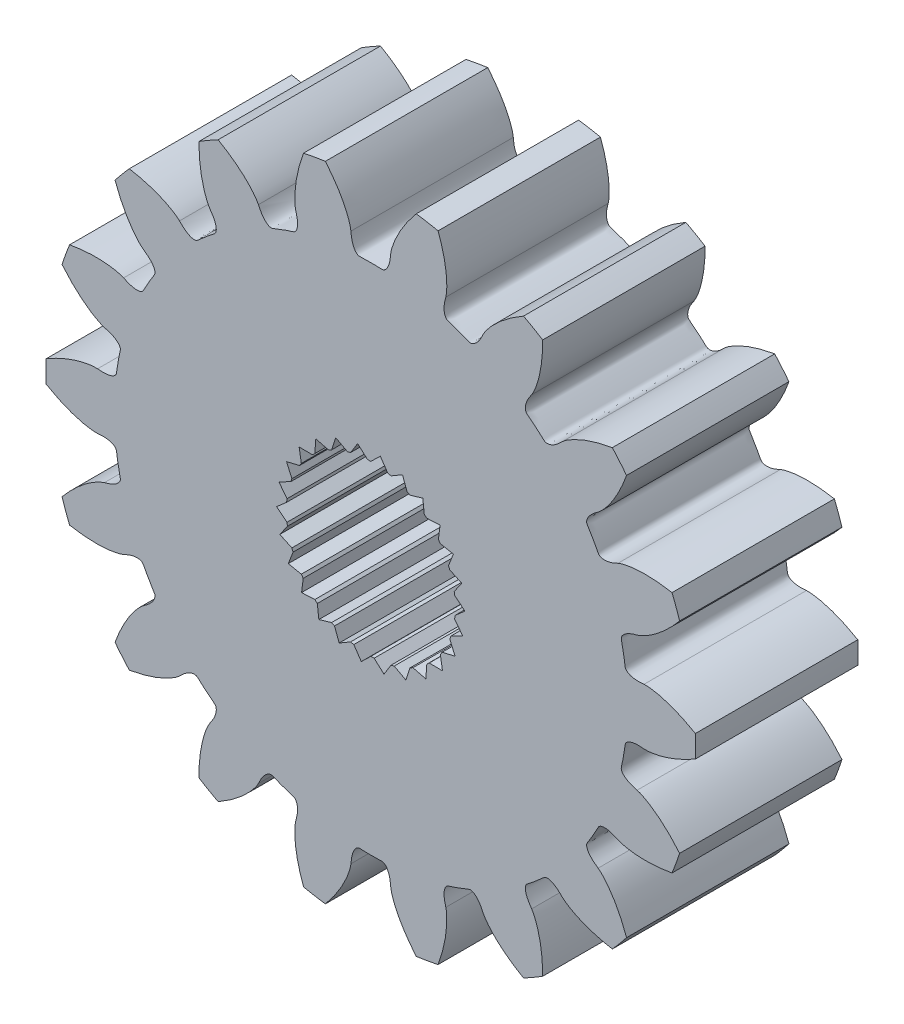
from build123d import *

# Parameters (mm, degrees)
BOSS_EXTRUDE1_DEPTH   = 5
IZIM1_R               = 2.6
KES_EKSTR_ZYON1_DEPTH = 4
IZIM3_R               = 0.95
KES_EKSTR_ZYON2_DEPTH = 15.630121998


with BuildPart() as part:
    # Model → Boss-Extrude1 (new body)
    with BuildSketch(Plane.XY):
        with BuildLine():
            ThreePointArc((-4.701939257, 8.825631265), (-5, 8.660254038), (-5.292251252, 8.484814476))
            add(Edge.make_bspline(
                [(-5.292251252, 8.484814476), (-5.291891635, 8.41467126), (-5.2911724, 8.274384291), (-5.278725206, 8.064251789), (-5.257404555, 7.854871363), (-5.225513528, 7.646803947), (-5.182173314, 7.440810054), (-5.135098328, 7.271767276), (-5.089713946, 7.138995986), (-5.050911451, 7.041215912), (-5.007874686, 6.94505322), (-4.971743121, 6.884900749), (-4.953682054, 6.854832365)],
                knots=[-0.1683093, -0.1683093, -0.1683093, -0.1683093, -0.14726919, -0.126228918, -0.105188912, -0.084149352, -0.063110491, -0.042072895, -0.031552683, -0.021032787, -0.010513648, 0, 0, 0, 0], degree=3))
            add(Edge.make_bspline(
                [(-4.953682054, 6.854832365), (-4.92962727, 6.821129291), (-4.881522109, 6.753729317), (-4.831274254, 6.662946551), (-4.797883212, 6.587157775), (-4.777404914, 6.528468048), (-4.762818133, 6.467994251), (-4.756375253, 6.406103034), (-4.761015283, 6.354003405), (-4.77405193, 6.314600894), (-4.794525367, 6.278147733), (-4.835324643, 6.244864353), (-4.901681916, 6.196008653), (-4.983427365, 6.132175875), (-5.077763526, 6.051442925), (-5.173651264, 5.972559072), (-5.250709227, 5.903139965), (-5.310345519, 5.846274512), (-5.350207969, 5.811874667), (-5.3896625, 5.798042292), (-5.430730188, 5.792045875), (-5.482844039, 5.796523343), (-5.542676195, 5.813615638), (-5.599698292, 5.838481978), (-5.653940371, 5.868840529), (-5.722779452, 5.914884869), (-5.803457574, 5.980133607), (-5.861480218, 6.039211826), (-5.890494197, 6.068753641)],
                knots=[-0.198614223, -0.198614223, -0.198614223, -0.198614223, -0.186198487, -0.173785025, -0.167576252, -0.161368033, -0.155160905, -0.148956532, -0.142760006, -0.139657124, -0.136554092, -0.130358143, -0.124146484, -0.111726376, -0.099307112, -0.086887847, -0.074467739, -0.06825608, -0.062060131, -0.0589571, -0.055854217, -0.049657691, -0.043453318, -0.03724619, -0.031037971, -0.024829198, -0.012415736, 0, 0, 0, 0], degree=3))
            add(Edge.make_bspline(
                [(-5.890494197, 6.068753641), (-5.916969504, 6.09176164), (-5.969933943, 6.137789652), (-6.057162452, 6.196871069), (-6.146719044, 6.252063398), (-6.269592325, 6.319813782), (-6.427892478, 6.395527563), (-6.623230911, 6.473979806), (-6.822599497, 6.541516864), (-7.025096671, 6.598872137), (-7.229875356, 6.647619356), (-7.367906157, 6.67268824), (-7.436921293, 6.685222635)],
                knots=[-0.1683093, -0.1683093, -0.1683093, -0.1683093, -0.157795652, -0.147276513, -0.136756617, -0.126236405, -0.10519881, -0.084159949, -0.063120388, -0.042080382, -0.021040111, 0, 0, 0, 0], degree=3))
            ThreePointArc((-7.436921293, 6.685222635), (-7.660444431, 6.427876097), (-7.875066912, 6.16306102))
            add(Edge.make_bspline(
                [(-7.875066912, 6.16306102), (-7.85073859, 6.097270953), (-7.802081761, 5.965690317), (-7.718515676, 5.772487546), (-7.626868494, 5.583026398), (-7.525737484, 5.398414356), (-7.414556944, 5.219666641), (-7.312504892, 5.076918983), (-7.224447067, 4.967677155), (-7.154541895, 4.889065176), (-7.081210986, 4.813421244), (-7.026685064, 4.769254134), (-6.999429219, 4.747176344)],
                knots=[-0.1683093, -0.1683093, -0.1683093, -0.1683093, -0.14726919, -0.126228918, -0.105188912, -0.084149352, -0.063110491, -0.042072895, -0.031552683, -0.021032787, -0.010513648, 0, 0, 0, 0], degree=3))
            add(Edge.make_bspline(
                [(-6.999429219, 4.747176344), (-6.965297987, 4.723733035), (-6.897041773, 4.67685071), (-6.8187747, 4.608728594), (-6.761476096, 4.54893085), (-6.722159722, 4.500784536), (-6.687769374, 4.448946728), (-6.660547004, 4.392991603), (-6.647088084, 4.342446983), (-6.645862073, 4.300961938), (-6.652633095, 4.259704844), (-6.679588287, 4.214474523), (-6.725234093, 4.145869658), (-6.780217593, 4.057927877), (-6.841252292, 3.949798853), (-6.904377425, 3.84287674), (-6.953045491, 3.751288742), (-6.989636144, 3.677455882), (-7.015329155, 3.631496841), (-7.047673336, 3.605004416), (-7.084213444, 3.585323651), (-7.134715829, 3.571707107), (-7.196785574, 3.567304809), (-7.258873606, 3.571168819), (-7.320227724, 3.581144642), (-7.400663392, 3.600867816), (-7.498792411, 3.634588031), (-7.573521802, 3.670258484), (-7.61088992, 3.688095344)],
                knots=[-0.198614223, -0.198614223, -0.198614223, -0.198614223, -0.186198487, -0.173785025, -0.167576252, -0.161368033, -0.155160905, -0.148956532, -0.142760006, -0.139657124, -0.136554092, -0.130358143, -0.124146484, -0.111726376, -0.099307112, -0.086887847, -0.074467739, -0.06825608, -0.062060131, -0.0589571, -0.055854217, -0.049657691, -0.043453318, -0.03724619, -0.031037971, -0.024829198, -0.012415736, 0, 0, 0, 0], degree=3))
            add(Edge.make_bspline(
                [(-7.61088992, 3.688095344), (-7.643637769, 3.700660703), (-7.709150569, 3.725797982), (-7.81132559, 3.751482445), (-7.914358147, 3.772716111), (-8.052993258, 3.79435551), (-8.227642383, 3.81136135), (-8.438032714, 3.818272665), (-8.648476938, 3.813548668), (-8.858378696, 3.798186882), (-9.067480246, 3.773955849), (-9.205760834, 3.750303581), (-9.274900864, 3.738477492)],
                knots=[-0.1683093, -0.1683093, -0.1683093, -0.1683093, -0.157795652, -0.147276513, -0.136756617, -0.126236405, -0.10519881, -0.084159949, -0.063120388, -0.042080382, -0.021040111, 0, 0, 0, 0], degree=3))
            ThreePointArc((-9.274900864, 3.738477492), (-9.396926208, 3.420201433), (-9.508033278, 3.097951448))
            add(Edge.make_bspline(
                [(-9.508033278, 3.097951448), (-9.462670606, 3.044449784), (-9.371944915, 2.937446047), (-9.227339242, 2.784476113), (-9.076419532, 2.637786052), (-8.918246431, 2.498896321), (-8.752635579, 2.368954397), (-8.607915445, 2.269719334), (-8.487805251, 2.197183143), (-8.395228996, 2.147221024), (-8.300448734, 2.101219627), (-8.234105085, 2.078365084), (-8.200941921, 2.066940795)],
                knots=[-0.1683093, -0.1683093, -0.1683093, -0.1683093, -0.14726919, -0.126228918, -0.105188912, -0.084149352, -0.063110491, -0.042072895, -0.031552683, -0.021032787, -0.010513648, 0, 0, 0, 0], degree=3))
            add(Edge.make_bspline(
                [(-8.200941921, 2.066940795), (-8.16085097, 2.05658486), (-8.080676409, 2.035874885), (-7.983830283, 1.998629951), (-7.909535175, 1.962035728), (-7.856122858, 1.930239985), (-7.806076928, 1.893290571), (-7.761358488, 1.850020552), (-7.731423962, 1.807127367), (-7.716083167, 1.768563497), (-7.70833509, 1.727478684), (-7.718195004, 1.675756867), (-7.737623785, 1.595677596), (-7.759213514, 1.494233889), (-7.779585066, 1.371750746), (-7.802333771, 1.249686759), (-7.816741853, 1.146976734), (-7.825873495, 1.0650818), (-7.834298109, 1.0131069), (-7.855630754, 0.977149804), (-7.883236006, 0.94615848), (-7.926035593, 0.916090282), (-7.982856399, 0.890724371), (-8.042521634, 0.873119996), (-8.103587578, 0.861509859), (-8.185918105, 0.852532961), (-8.289662213, 0.850657497), (-8.372084884, 0.858617802), (-8.413299993, 0.862598319)],
                knots=[-0.198614223, -0.198614223, -0.198614223, -0.198614223, -0.186198487, -0.173785025, -0.167576252, -0.161368033, -0.155160905, -0.148956532, -0.142760006, -0.139657124, -0.136554092, -0.130358143, -0.124146484, -0.111726376, -0.099307112, -0.086887847, -0.074467739, -0.06825608, -0.062060131, -0.0589571, -0.055854217, -0.049657691, -0.043453318, -0.03724619, -0.031037971, -0.024829198, -0.012415736, 0, 0, 0, 0], degree=3))
            add(Edge.make_bspline(
                [(-8.413299993, 0.862598319), (-8.448370511, 0.863205469), (-8.518529862, 0.864420087), (-8.623327579, 0.853609673), (-8.727408854, 0.838323582), (-8.865084356, 0.811241965), (-9.035017189, 0.767488709), (-9.23508324, 0.702025489), (-9.431220421, 0.625610221), (-9.623209515, 0.539384234), (-9.811413197, 0.445097569), (-9.933264893, 0.375576961), (-9.994190508, 0.340816789)],
                knots=[-0.1683093, -0.1683093, -0.1683093, -0.1683093, -0.157795652, -0.147276513, -0.136756617, -0.126236405, -0.10519881, -0.084159949, -0.063120388, -0.042080382, -0.021040111, 0, 0, 0, 0], degree=3))
            ThreePointArc((-9.994190508, 0.340816789), (-10, 0), (-9.994190508, -0.340816789))
            add(Edge.make_bspline(
                [(-9.994190508, -0.340816789), (-9.933264893, -0.375576961), (-9.811413197, -0.445097569), (-9.623209515, -0.539384234), (-9.431220421, -0.625610221), (-9.23508324, -0.702025489), (-9.035017189, -0.767488709), (-8.865084356, -0.811241965), (-8.727408854, -0.838323582), (-8.623327579, -0.853609673), (-8.518529862, -0.864420087), (-8.448370511, -0.863205469), (-8.413299993, -0.862598319)],
                knots=[-0.1683093, -0.1683093, -0.1683093, -0.1683093, -0.14726919, -0.126228918, -0.105188912, -0.084149352, -0.063110491, -0.042072895, -0.031552683, -0.021032787, -0.010513648, 0, 0, 0, 0], degree=3))
            add(Edge.make_bspline(
                [(-8.413299993, -0.862598319), (-8.372084884, -0.858617802), (-8.289662213, -0.850657497), (-8.185918105, -0.852532961), (-8.103587578, -0.861509859), (-8.042521634, -0.873119996), (-7.982856399, -0.890724371), (-7.926035593, -0.916090282), (-7.883236006, -0.94615848), (-7.855630754, -0.977149804), (-7.834298109, -1.0131069), (-7.825873495, -1.0650818), (-7.816741853, -1.146976734), (-7.802333771, -1.249686759), (-7.779585066, -1.371750746), (-7.759213514, -1.494233889), (-7.737623785, -1.595677596), (-7.718195004, -1.675756867), (-7.70833509, -1.727478684), (-7.716083167, -1.768563497), (-7.731423962, -1.807127367), (-7.761358488, -1.850020552), (-7.806076928, -1.893290571), (-7.856122858, -1.930239985), (-7.909535175, -1.962035728), (-7.983830283, -1.998629951), (-8.080676409, -2.035874885), (-8.16085097, -2.05658486), (-8.200941921, -2.066940795)],
                knots=[-0.198614223, -0.198614223, -0.198614223, -0.198614223, -0.186198487, -0.173785025, -0.167576252, -0.161368033, -0.155160905, -0.148956532, -0.142760006, -0.139657124, -0.136554092, -0.130358143, -0.124146484, -0.111726376, -0.099307112, -0.086887847, -0.074467739, -0.06825608, -0.062060131, -0.0589571, -0.055854217, -0.049657691, -0.043453318, -0.03724619, -0.031037971, -0.024829198, -0.012415736, 0, 0, 0, 0], degree=3))
            add(Edge.make_bspline(
                [(-8.200941921, -2.066940795), (-8.234105085, -2.078365084), (-8.300448734, -2.101219627), (-8.395228996, -2.147221024), (-8.487805251, -2.197183143), (-8.607915445, -2.269719334), (-8.752635579, -2.368954397), (-8.918246431, -2.498896321), (-9.076419532, -2.637786052), (-9.227339242, -2.784476113), (-9.371944915, -2.937446047), (-9.462670606, -3.044449784), (-9.508033278, -3.097951448)],
                knots=[-0.1683093, -0.1683093, -0.1683093, -0.1683093, -0.157795652, -0.147276513, -0.136756617, -0.126236405, -0.10519881, -0.084159949, -0.063120388, -0.042080382, -0.021040111, 0, 0, 0, 0], degree=3))
            ThreePointArc((-9.508033278, -3.097951448), (-9.396926208, -3.420201433), (-9.274900864, -3.738477492))
            add(Edge.make_bspline(
                [(-9.274900864, -3.738477492), (-9.205760834, -3.750303581), (-9.067480246, -3.773955849), (-8.858378696, -3.798186882), (-8.648476938, -3.813548668), (-8.438032714, -3.818272665), (-8.227642383, -3.81136135), (-8.052993258, -3.79435551), (-7.914358147, -3.772716111), (-7.81132559, -3.751482445), (-7.709150569, -3.725797982), (-7.643637769, -3.700660703), (-7.61088992, -3.688095344)],
                knots=[-0.1683093, -0.1683093, -0.1683093, -0.1683093, -0.14726919, -0.126228918, -0.105188912, -0.084149352, -0.063110491, -0.042072895, -0.031552683, -0.021032787, -0.010513648, 0, 0, 0, 0], degree=3))
            add(Edge.make_bspline(
                [(-7.61088992, -3.688095344), (-7.573521802, -3.670258484), (-7.498792411, -3.634588031), (-7.400663392, -3.600867816), (-7.320227724, -3.581144642), (-7.258873606, -3.571168819), (-7.196785574, -3.567304809), (-7.134715829, -3.571707107), (-7.084213444, -3.585323651), (-7.047673336, -3.605004416), (-7.015329155, -3.631496841), (-6.989636144, -3.677455882), (-6.953045491, -3.751288742), (-6.904377425, -3.84287674), (-6.841252292, -3.949798853), (-6.780217593, -4.057927877), (-6.725234093, -4.145869658), (-6.679588287, -4.214474523), (-6.652633095, -4.259704844), (-6.645862073, -4.300961938), (-6.647088084, -4.342446983), (-6.660547004, -4.392991603), (-6.687769374, -4.448946728), (-6.722159722, -4.500784536), (-6.761476096, -4.54893085), (-6.8187747, -4.608728594), (-6.897041773, -4.67685071), (-6.965297987, -4.723733035), (-6.999429219, -4.747176344)],
                knots=[-0.198614223, -0.198614223, -0.198614223, -0.198614223, -0.186198487, -0.173785025, -0.167576252, -0.161368033, -0.155160905, -0.148956532, -0.142760006, -0.139657124, -0.136554092, -0.130358143, -0.124146484, -0.111726376, -0.099307112, -0.086887847, -0.074467739, -0.06825608, -0.062060131, -0.0589571, -0.055854217, -0.049657691, -0.043453318, -0.03724619, -0.031037971, -0.024829198, -0.012415736, 0, 0, 0, 0], degree=3))
            add(Edge.make_bspline(
                [(-6.999429219, -4.747176344), (-7.026685064, -4.769254134), (-7.081210986, -4.813421244), (-7.154541895, -4.889065176), (-7.224447067, -4.967677155), (-7.312504892, -5.076918983), (-7.414556944, -5.219666641), (-7.525737484, -5.398414356), (-7.626868494, -5.583026398), (-7.718515676, -5.772487546), (-7.802081761, -5.965690317), (-7.85073859, -6.097270953), (-7.875066912, -6.16306102)],
                knots=[-0.1683093, -0.1683093, -0.1683093, -0.1683093, -0.157795652, -0.147276513, -0.136756617, -0.126236405, -0.10519881, -0.084159949, -0.063120388, -0.042080382, -0.021040111, 0, 0, 0, 0], degree=3))
            ThreePointArc((-7.875066912, -6.16306102), (-7.660444431, -6.427876097), (-7.436921293, -6.685222635))
            add(Edge.make_bspline(
                [(-7.436921293, -6.685222635), (-7.367906157, -6.67268824), (-7.229875356, -6.647619356), (-7.025096671, -6.598872137), (-6.822599497, -6.541516864), (-6.623230911, -6.473979806), (-6.427892478, -6.395527563), (-6.269592325, -6.319813782), (-6.146719044, -6.252063398), (-6.057162452, -6.196871069), (-5.969933943, -6.137789652), (-5.916969504, -6.09176164), (-5.890494197, -6.068753641)],
                knots=[-0.1683093, -0.1683093, -0.1683093, -0.1683093, -0.14726919, -0.126228918, -0.105188912, -0.084149352, -0.063110491, -0.042072895, -0.031552683, -0.021032787, -0.010513648, 0, 0, 0, 0], degree=3))
            add(Edge.make_bspline(
                [(-5.890494197, -6.068753641), (-5.861480218, -6.039211826), (-5.803457574, -5.980133607), (-5.722779452, -5.914884869), (-5.653940371, -5.868840529), (-5.599698292, -5.838481978), (-5.542676195, -5.813615638), (-5.482844039, -5.796523343), (-5.430730188, -5.792045875), (-5.3896625, -5.798042292), (-5.350207969, -5.811874667), (-5.310345519, -5.846274512), (-5.250709227, -5.903139965), (-5.173651264, -5.972559072), (-5.077763526, -6.051442925), (-4.983427365, -6.132175875), (-4.901681916, -6.196008653), (-4.835324643, -6.244864353), (-4.794525367, -6.278147733), (-4.77405193, -6.314600894), (-4.761015283, -6.354003405), (-4.756375253, -6.406103034), (-4.762818133, -6.467994251), (-4.777404914, -6.528468048), (-4.797883212, -6.587157775), (-4.831274254, -6.662946551), (-4.881522109, -6.753729317), (-4.92962727, -6.821129291), (-4.953682054, -6.854832365)],
                knots=[-0.198614223, -0.198614223, -0.198614223, -0.198614223, -0.186198487, -0.173785025, -0.167576252, -0.161368033, -0.155160905, -0.148956532, -0.142760006, -0.139657124, -0.136554092, -0.130358143, -0.124146484, -0.111726376, -0.099307112, -0.086887847, -0.074467739, -0.06825608, -0.062060131, -0.0589571, -0.055854217, -0.049657691, -0.043453318, -0.03724619, -0.031037971, -0.024829198, -0.012415736, 0, 0, 0, 0], degree=3))
            add(Edge.make_bspline(
                [(-4.953682054, -6.854832365), (-4.971743121, -6.884900749), (-5.007874686, -6.94505322), (-5.050911451, -7.041215912), (-5.089713946, -7.138995986), (-5.135098328, -7.271767276), (-5.182173314, -7.440810054), (-5.225513528, -7.646803947), (-5.257404555, -7.854871363), (-5.278725206, -8.064251789), (-5.2911724, -8.274384291), (-5.291891635, -8.41467126), (-5.292251252, -8.484814476)],
                knots=[-0.1683093, -0.1683093, -0.1683093, -0.1683093, -0.157795652, -0.147276513, -0.136756617, -0.126236405, -0.10519881, -0.084159949, -0.063120388, -0.042080382, -0.021040111, 0, 0, 0, 0], degree=3))
            ThreePointArc((-5.292251252, -8.484814476), (-5, -8.660254038), (-4.701939257, -8.825631265))
            add(Edge.make_bspline(
                [(-4.701939257, -8.825631265), (-4.641373258, -8.79024822), (-4.520240797, -8.71948186), (-4.344484308, -8.603636023), (-4.173815867, -8.480481584), (-4.009569712, -8.348829436), (-3.852843875, -8.208298764), (-3.729986027, -8.083009241), (-3.637694908, -7.977319568), (-3.572416128, -7.894825585), (-3.510655176, -7.809473307), (-3.476627391, -7.748106218), (-3.45961794, -7.717430683)],
                knots=[-0.1683093, -0.1683093, -0.1683093, -0.1683093, -0.14726919, -0.126228918, -0.105188912, -0.084149352, -0.063110491, -0.042072895, -0.031552683, -0.021032787, -0.010513648, 0, 0, 0, 0], degree=3))
            add(Edge.make_bspline(
                [(-3.45961794, -7.717430683), (-3.442457614, -7.679747093), (-3.408140104, -7.604386814), (-3.35464385, -7.515479513), (-3.305704366, -7.448667634), (-3.26511672, -7.401588044), (-3.220038266, -7.358718622), (-3.16966034, -7.322193316), (-3.122220723, -7.300161885), (-3.081578824, -7.291750698), (-3.039772742, -7.291254634), (-2.990548852, -7.309946153), (-2.915059938, -7.342985387), (-2.818906405, -7.381862634), (-2.701821539, -7.423193671), (-2.58556225, -7.466792961), (-2.486914558, -7.498817561), (-2.407849485, -7.522031378), (-2.35812712, -7.53935335), (-2.326420667, -7.566605789), (-2.300693774, -7.599173242), (-2.278514449, -7.646543894), (-2.263400733, -7.706906209), (-2.256424567, -7.768721963), (-2.255594804, -7.830876257), (-2.261050831, -7.91351482), (-2.277218835, -8.016008493), (-2.299370751, -8.095796686), (-2.310447724, -8.135694436)],
                knots=[-0.198614223, -0.198614223, -0.198614223, -0.198614223, -0.186198487, -0.173785025, -0.167576252, -0.161368033, -0.155160905, -0.148956532, -0.142760006, -0.139657124, -0.136554092, -0.130358143, -0.124146484, -0.111726376, -0.099307112, -0.086887847, -0.074467739, -0.06825608, -0.062060131, -0.0589571, -0.055854217, -0.049657691, -0.043453318, -0.03724619, -0.031037971, -0.024829198, -0.012415736, 0, 0, 0, 0], degree=3))
            add(Edge.make_bspline(
                [(-2.310447724, -8.135694436), (-2.317135582, -8.170126723), (-2.330514791, -8.23900928), (-2.338066544, -8.344092093), (-2.341086207, -8.449246541), (-2.33832312, -8.589533116), (-2.324743101, -8.76448196), (-2.29501552, -8.972876127), (-2.253820035, -9.179302917), (-2.202242571, -9.38334825), (-2.142069559, -9.585065403), (-2.09476445, -9.717138024), (-2.071111985, -9.783174083)],
                knots=[-0.1683093, -0.1683093, -0.1683093, -0.1683093, -0.157795652, -0.147276513, -0.136756617, -0.126236405, -0.10519881, -0.084159949, -0.063120388, -0.042080382, -0.021040111, 0, 0, 0, 0], degree=3))
            ThreePointArc((-2.071111985, -9.783174083), (-1.736481777, -9.84807753), (-1.399833953, -9.901538512))
            add(Edge.make_bspline(
                [(-1.399833953, -9.901538512), (-1.355022244, -9.847574534), (-1.265398485, -9.739646166), (-1.13986302, -9.570674428), (-1.021608444, -9.396575066), (-0.91229523, -9.216687021), (-0.813085439, -9.031027992), (-0.740488367, -8.871274493), (-0.68991108, -8.740393266), (-0.656783695, -8.640547621), (-0.627939583, -8.539219225), (-0.616952705, -8.469914837), (-0.6114607, -8.435271688)],
                knots=[-0.1683093, -0.1683093, -0.1683093, -0.1683093, -0.14726919, -0.126228918, -0.105188912, -0.084149352, -0.063110491, -0.042072895, -0.031552683, -0.021032787, -0.010513648, 0, 0, 0, 0], degree=3))
            add(Edge.make_bspline(
                [(-0.6114607, -8.435271688), (-0.608223815, -8.393991519), (-0.601750639, -8.311438741), (-0.581888691, -8.20959641), (-0.558751628, -8.130075491), (-0.536713885, -8.071953355), (-0.5090162, -8.016251537), (-0.474168825, -7.96469871), (-0.43712536, -7.927770633), (-0.401811262, -7.905966355), (-0.36269606, -7.891201685), (-0.310047857, -7.891930405), (-0.227811398, -7.8971584), (-0.124159832, -7.900804617), (0, -7.899597705), (0.124159832, -7.900804617), (0.227811398, -7.8971584), (0.310047857, -7.891930405), (0.36269606, -7.891201685), (0.401811262, -7.905966355), (0.43712536, -7.927770633), (0.474168825, -7.96469871), (0.5090162, -8.016251537), (0.536713885, -8.071953355), (0.558751628, -8.130075491), (0.581888691, -8.20959641), (0.601750639, -8.311438741), (0.608223815, -8.393991519), (0.6114607, -8.435271688)],
                knots=[-0.198614223, -0.198614223, -0.198614223, -0.198614223, -0.186198487, -0.173785025, -0.167576252, -0.161368033, -0.155160905, -0.148956532, -0.142760006, -0.139657124, -0.136554092, -0.130358143, -0.124146484, -0.111726376, -0.099307112, -0.086887847, -0.074467739, -0.06825608, -0.062060131, -0.0589571, -0.055854217, -0.049657691, -0.043453318, -0.03724619, -0.031037971, -0.024829198, -0.012415736, 0, 0, 0, 0], degree=3))
            add(Edge.make_bspline(
                [(0.6114607, -8.435271688), (0.616952705, -8.469914837), (0.627939583, -8.539219225), (0.656783695, -8.640547621), (0.68991108, -8.740393266), (0.740488367, -8.871274493), (0.813085439, -9.031027992), (0.91229523, -9.216687021), (1.021608444, -9.396575066), (1.13986302, -9.570674428), (1.265398485, -9.739646166), (1.355022244, -9.847574534), (1.399833953, -9.901538512)],
                knots=[-0.1683093, -0.1683093, -0.1683093, -0.1683093, -0.157795652, -0.147276513, -0.136756617, -0.126236405, -0.10519881, -0.084159949, -0.063120388, -0.042080382, -0.021040111, 0, 0, 0, 0], degree=3))
            ThreePointArc((1.399833953, -9.901538512), (1.736481777, -9.84807753), (2.071111985, -9.783174083))
            add(Edge.make_bspline(
                [(2.071111985, -9.783174083), (2.09476445, -9.717138024), (2.142069559, -9.585065403), (2.202242571, -9.38334825), (2.253820035, -9.179302917), (2.29501552, -8.972876127), (2.324743101, -8.76448196), (2.33832312, -8.589533116), (2.341086207, -8.449246541), (2.338066544, -8.344092093), (2.330514791, -8.23900928), (2.317135582, -8.170126723), (2.310447724, -8.135694436)],
                knots=[-0.1683093, -0.1683093, -0.1683093, -0.1683093, -0.14726919, -0.126228918, -0.105188912, -0.084149352, -0.063110491, -0.042072895, -0.031552683, -0.021032787, -0.010513648, 0, 0, 0, 0], degree=3))
            add(Edge.make_bspline(
                [(2.310447724, -8.135694436), (2.299370751, -8.095796686), (2.277218835, -8.016008493), (2.261050831, -7.91351482), (2.255594804, -7.830876257), (2.256424567, -7.768721963), (2.263400733, -7.706906209), (2.278514449, -7.646543894), (2.300693774, -7.599173242), (2.326420667, -7.566605789), (2.35812712, -7.53935335), (2.407849485, -7.522031378), (2.486914558, -7.498817561), (2.58556225, -7.466792961), (2.701821539, -7.423193671), (2.818906405, -7.381862634), (2.915059938, -7.342985387), (2.990548852, -7.309946153), (3.039772742, -7.291254634), (3.081578824, -7.291750698), (3.122220723, -7.300161885), (3.16966034, -7.322193316), (3.220038266, -7.358718622), (3.26511672, -7.401588044), (3.305704366, -7.448667634), (3.35464385, -7.515479513), (3.408140104, -7.604386814), (3.442457614, -7.679747093), (3.45961794, -7.717430683)],
                knots=[-0.198614223, -0.198614223, -0.198614223, -0.198614223, -0.186198487, -0.173785025, -0.167576252, -0.161368033, -0.155160905, -0.148956532, -0.142760006, -0.139657124, -0.136554092, -0.130358143, -0.124146484, -0.111726376, -0.099307112, -0.086887847, -0.074467739, -0.06825608, -0.062060131, -0.0589571, -0.055854217, -0.049657691, -0.043453318, -0.03724619, -0.031037971, -0.024829198, -0.012415736, 0, 0, 0, 0], degree=3))
            add(Edge.make_bspline(
                [(3.45961794, -7.717430683), (3.476627391, -7.748106218), (3.510655176, -7.809473307), (3.572416128, -7.894825585), (3.637694908, -7.977319568), (3.729986027, -8.083009241), (3.852843875, -8.208298764), (4.009569712, -8.348829436), (4.173815867, -8.480481584), (4.344484308, -8.603636023), (4.520240797, -8.71948186), (4.641373258, -8.79024822), (4.701939257, -8.825631265)],
                knots=[-0.1683093, -0.1683093, -0.1683093, -0.1683093, -0.157795652, -0.147276513, -0.136756617, -0.126236405, -0.10519881, -0.084159949, -0.063120388, -0.042080382, -0.021040111, 0, 0, 0, 0], degree=3))
            ThreePointArc((4.701939257, -8.825631265), (5, -8.660254038), (5.292251252, -8.484814476))
            add(Edge.make_bspline(
                [(5.292251252, -8.484814476), (5.291891635, -8.41467126), (5.2911724, -8.274384291), (5.278725206, -8.064251789), (5.257404555, -7.854871363), (5.225513528, -7.646803947), (5.182173314, -7.440810054), (5.135098328, -7.271767276), (5.089713946, -7.138995986), (5.050911451, -7.041215912), (5.007874686, -6.94505322), (4.971743121, -6.884900749), (4.953682054, -6.854832365)],
                knots=[-0.1683093, -0.1683093, -0.1683093, -0.1683093, -0.14726919, -0.126228918, -0.105188912, -0.084149352, -0.063110491, -0.042072895, -0.031552683, -0.021032787, -0.010513648, 0, 0, 0, 0], degree=3))
            add(Edge.make_bspline(
                [(4.953682054, -6.854832365), (4.92962727, -6.821129291), (4.881522109, -6.753729317), (4.831274254, -6.662946551), (4.797883212, -6.587157775), (4.777404914, -6.528468048), (4.762818133, -6.467994251), (4.756375253, -6.406103034), (4.761015283, -6.354003405), (4.77405193, -6.314600894), (4.794525367, -6.278147733), (4.835324643, -6.244864353), (4.901681916, -6.196008653), (4.983427365, -6.132175875), (5.077763526, -6.051442925), (5.173651264, -5.972559072), (5.250709227, -5.903139965), (5.310345519, -5.846274512), (5.350207969, -5.811874667), (5.3896625, -5.798042292), (5.430730188, -5.792045875), (5.482844039, -5.796523343), (5.542676195, -5.813615638), (5.599698292, -5.838481978), (5.653940371, -5.868840529), (5.722779452, -5.914884869), (5.803457574, -5.980133607), (5.861480218, -6.039211826), (5.890494197, -6.068753641)],
                knots=[-0.198614223, -0.198614223, -0.198614223, -0.198614223, -0.186198487, -0.173785025, -0.167576252, -0.161368033, -0.155160905, -0.148956532, -0.142760006, -0.139657124, -0.136554092, -0.130358143, -0.124146484, -0.111726376, -0.099307112, -0.086887847, -0.074467739, -0.06825608, -0.062060131, -0.0589571, -0.055854217, -0.049657691, -0.043453318, -0.03724619, -0.031037971, -0.024829198, -0.012415736, 0, 0, 0, 0], degree=3))
            add(Edge.make_bspline(
                [(5.890494197, -6.068753641), (5.916969504, -6.09176164), (5.969933943, -6.137789652), (6.057162452, -6.196871069), (6.146719044, -6.252063398), (6.269592325, -6.319813782), (6.427892478, -6.395527563), (6.623230911, -6.473979806), (6.822599497, -6.541516864), (7.025096671, -6.598872137), (7.229875356, -6.647619356), (7.367906157, -6.67268824), (7.436921293, -6.685222635)],
                knots=[-0.1683093, -0.1683093, -0.1683093, -0.1683093, -0.157795652, -0.147276513, -0.136756617, -0.126236405, -0.10519881, -0.084159949, -0.063120388, -0.042080382, -0.021040111, 0, 0, 0, 0], degree=3))
            ThreePointArc((7.436921293, -6.685222635), (7.660444431, -6.427876097), (7.875066912, -6.16306102))
            add(Edge.make_bspline(
                [(7.875066912, -6.16306102), (7.85073859, -6.097270953), (7.802081761, -5.965690317), (7.718515676, -5.772487546), (7.626868494, -5.583026398), (7.525737484, -5.398414356), (7.414556944, -5.219666641), (7.312504892, -5.076918983), (7.224447067, -4.967677155), (7.154541895, -4.889065176), (7.081210986, -4.813421244), (7.026685064, -4.769254134), (6.999429219, -4.747176344)],
                knots=[-0.1683093, -0.1683093, -0.1683093, -0.1683093, -0.14726919, -0.126228918, -0.105188912, -0.084149352, -0.063110491, -0.042072895, -0.031552683, -0.021032787, -0.010513648, 0, 0, 0, 0], degree=3))
            add(Edge.make_bspline(
                [(6.999429219, -4.747176344), (6.965297987, -4.723733035), (6.897041773, -4.67685071), (6.8187747, -4.608728594), (6.761476096, -4.54893085), (6.722159722, -4.500784536), (6.687769374, -4.448946728), (6.660547004, -4.392991603), (6.647088084, -4.342446983), (6.645862073, -4.300961938), (6.652633095, -4.259704844), (6.679588287, -4.214474523), (6.725234093, -4.145869658), (6.780217593, -4.057927877), (6.841252292, -3.949798853), (6.904377425, -3.84287674), (6.953045491, -3.751288742), (6.989636144, -3.677455882), (7.015329155, -3.631496841), (7.047673336, -3.605004416), (7.084213444, -3.585323651), (7.134715829, -3.571707107), (7.196785574, -3.567304809), (7.258873606, -3.571168819), (7.320227724, -3.581144642), (7.400663392, -3.600867816), (7.498792411, -3.634588031), (7.573521802, -3.670258484), (7.61088992, -3.688095344)],
                knots=[-0.198614223, -0.198614223, -0.198614223, -0.198614223, -0.186198487, -0.173785025, -0.167576252, -0.161368033, -0.155160905, -0.148956532, -0.142760006, -0.139657124, -0.136554092, -0.130358143, -0.124146484, -0.111726376, -0.099307112, -0.086887847, -0.074467739, -0.06825608, -0.062060131, -0.0589571, -0.055854217, -0.049657691, -0.043453318, -0.03724619, -0.031037971, -0.024829198, -0.012415736, 0, 0, 0, 0], degree=3))
            add(Edge.make_bspline(
                [(7.61088992, -3.688095344), (7.643637769, -3.700660703), (7.709150569, -3.725797982), (7.81132559, -3.751482445), (7.914358147, -3.772716111), (8.052993258, -3.79435551), (8.227642383, -3.81136135), (8.438032714, -3.818272665), (8.648476938, -3.813548668), (8.858378696, -3.798186882), (9.067480246, -3.773955849), (9.205760834, -3.750303581), (9.274900864, -3.738477492)],
                knots=[-0.1683093, -0.1683093, -0.1683093, -0.1683093, -0.157795652, -0.147276513, -0.136756617, -0.126236405, -0.10519881, -0.084159949, -0.063120388, -0.042080382, -0.021040111, 0, 0, 0, 0], degree=3))
            ThreePointArc((9.274900864, -3.738477492), (9.396926208, -3.420201433), (9.508033278, -3.097951448))
            add(Edge.make_bspline(
                [(9.508033278, -3.097951448), (9.462670606, -3.044449784), (9.371944915, -2.937446047), (9.227339242, -2.784476113), (9.076419532, -2.637786052), (8.918246431, -2.498896321), (8.752635579, -2.368954397), (8.607915445, -2.269719334), (8.487805251, -2.197183143), (8.395228996, -2.147221024), (8.300448734, -2.101219627), (8.234105085, -2.078365084), (8.200941921, -2.066940795)],
                knots=[-0.1683093, -0.1683093, -0.1683093, -0.1683093, -0.14726919, -0.126228918, -0.105188912, -0.084149352, -0.063110491, -0.042072895, -0.031552683, -0.021032787, -0.010513648, 0, 0, 0, 0], degree=3))
            add(Edge.make_bspline(
                [(8.200941921, -2.066940795), (8.16085097, -2.05658486), (8.080676409, -2.035874885), (7.983830283, -1.998629951), (7.909535175, -1.962035728), (7.856122858, -1.930239985), (7.806076928, -1.893290571), (7.761358488, -1.850020552), (7.731423962, -1.807127367), (7.716083167, -1.768563497), (7.70833509, -1.727478684), (7.718195004, -1.675756867), (7.737623785, -1.595677596), (7.759213514, -1.494233889), (7.779585066, -1.371750746), (7.802333771, -1.249686759), (7.816741853, -1.146976734), (7.825873495, -1.0650818), (7.834298109, -1.0131069), (7.855630754, -0.977149804), (7.883236006, -0.94615848), (7.926035593, -0.916090282), (7.982856399, -0.890724371), (8.042521634, -0.873119996), (8.103587578, -0.861509859), (8.185918105, -0.852532961), (8.289662213, -0.850657497), (8.372084884, -0.858617802), (8.413299993, -0.862598319)],
                knots=[-0.198614223, -0.198614223, -0.198614223, -0.198614223, -0.186198487, -0.173785025, -0.167576252, -0.161368033, -0.155160905, -0.148956532, -0.142760006, -0.139657124, -0.136554092, -0.130358143, -0.124146484, -0.111726376, -0.099307112, -0.086887847, -0.074467739, -0.06825608, -0.062060131, -0.0589571, -0.055854217, -0.049657691, -0.043453318, -0.03724619, -0.031037971, -0.024829198, -0.012415736, 0, 0, 0, 0], degree=3))
            add(Edge.make_bspline(
                [(8.413299993, -0.862598319), (8.448370511, -0.863205469), (8.518529862, -0.864420087), (8.623327579, -0.853609673), (8.727408854, -0.838323582), (8.865084356, -0.811241965), (9.035017189, -0.767488709), (9.23508324, -0.702025489), (9.431220421, -0.625610221), (9.623209515, -0.539384234), (9.811413197, -0.445097569), (9.933264893, -0.375576961), (9.994190508, -0.340816789)],
                knots=[-0.1683093, -0.1683093, -0.1683093, -0.1683093, -0.157795652, -0.147276513, -0.136756617, -0.126236405, -0.10519881, -0.084159949, -0.063120388, -0.042080382, -0.021040111, 0, 0, 0, 0], degree=3))
            ThreePointArc((9.994190508, -0.340816789), (10, 0), (9.994190508, 0.340816789))
            add(Edge.make_bspline(
                [(9.994190508, 0.340816789), (9.933264893, 0.375576961), (9.811413197, 0.445097569), (9.623209515, 0.539384234), (9.431220421, 0.625610221), (9.23508324, 0.702025489), (9.035017189, 0.767488709), (8.865084356, 0.811241965), (8.727408854, 0.838323582), (8.623327579, 0.853609673), (8.518529862, 0.864420087), (8.448370511, 0.863205469), (8.413299993, 0.862598319)],
                knots=[-0.1683093, -0.1683093, -0.1683093, -0.1683093, -0.14726919, -0.126228918, -0.105188912, -0.084149352, -0.063110491, -0.042072895, -0.031552683, -0.021032787, -0.010513648, 0, 0, 0, 0], degree=3))
            add(Edge.make_bspline(
                [(8.413299993, 0.862598319), (8.372084884, 0.858617802), (8.289662213, 0.850657497), (8.185918105, 0.852532961), (8.103587578, 0.861509859), (8.042521634, 0.873119996), (7.982856399, 0.890724371), (7.926035593, 0.916090282), (7.883236006, 0.94615848), (7.855630754, 0.977149804), (7.834298109, 1.0131069), (7.825873495, 1.0650818), (7.816741853, 1.146976734), (7.802333771, 1.249686759), (7.779585066, 1.371750746), (7.759213514, 1.494233889), (7.737623785, 1.595677596), (7.718195004, 1.675756867), (7.70833509, 1.727478684), (7.716083167, 1.768563497), (7.731423962, 1.807127367), (7.761358488, 1.850020552), (7.806076928, 1.893290571), (7.856122858, 1.930239985), (7.909535175, 1.962035728), (7.983830283, 1.998629951), (8.080676409, 2.035874885), (8.16085097, 2.05658486), (8.200941921, 2.066940795)],
                knots=[-0.198614223, -0.198614223, -0.198614223, -0.198614223, -0.186198487, -0.173785025, -0.167576252, -0.161368033, -0.155160905, -0.148956532, -0.142760006, -0.139657124, -0.136554092, -0.130358143, -0.124146484, -0.111726376, -0.099307112, -0.086887847, -0.074467739, -0.06825608, -0.062060131, -0.0589571, -0.055854217, -0.049657691, -0.043453318, -0.03724619, -0.031037971, -0.024829198, -0.012415736, 0, 0, 0, 0], degree=3))
            add(Edge.make_bspline(
                [(8.200941921, 2.066940795), (8.234105085, 2.078365084), (8.300448734, 2.101219627), (8.395228996, 2.147221024), (8.487805251, 2.197183143), (8.607915445, 2.269719334), (8.752635579, 2.368954397), (8.918246431, 2.498896321), (9.076419532, 2.637786052), (9.227339242, 2.784476113), (9.371944915, 2.937446047), (9.462670606, 3.044449784), (9.508033278, 3.097951448)],
                knots=[-0.1683093, -0.1683093, -0.1683093, -0.1683093, -0.157795652, -0.147276513, -0.136756617, -0.126236405, -0.10519881, -0.084159949, -0.063120388, -0.042080382, -0.021040111, 0, 0, 0, 0], degree=3))
            ThreePointArc((9.508033278, 3.097951448), (9.396926208, 3.420201433), (9.274900864, 3.738477492))
            add(Edge.make_bspline(
                [(9.274900864, 3.738477492), (9.205760834, 3.750303581), (9.067480246, 3.773955849), (8.858378696, 3.798186882), (8.648476938, 3.813548668), (8.438032714, 3.818272665), (8.227642383, 3.81136135), (8.052993258, 3.79435551), (7.914358147, 3.772716111), (7.81132559, 3.751482445), (7.709150569, 3.725797982), (7.643637769, 3.700660703), (7.61088992, 3.688095344)],
                knots=[-0.1683093, -0.1683093, -0.1683093, -0.1683093, -0.14726919, -0.126228918, -0.105188912, -0.084149352, -0.063110491, -0.042072895, -0.031552683, -0.021032787, -0.010513648, 0, 0, 0, 0], degree=3))
            add(Edge.make_bspline(
                [(7.61088992, 3.688095344), (7.573521802, 3.670258484), (7.498792411, 3.634588031), (7.400663392, 3.600867816), (7.320227724, 3.581144642), (7.258873606, 3.571168819), (7.196785574, 3.567304809), (7.134715829, 3.571707107), (7.084213444, 3.585323651), (7.047673336, 3.605004416), (7.015329155, 3.631496841), (6.989636144, 3.677455882), (6.953045491, 3.751288742), (6.904377425, 3.84287674), (6.841252292, 3.949798853), (6.780217593, 4.057927877), (6.725234093, 4.145869658), (6.679588287, 4.214474523), (6.652633095, 4.259704844), (6.645862073, 4.300961938), (6.647088084, 4.342446983), (6.660547004, 4.392991603), (6.687769374, 4.448946728), (6.722159722, 4.500784536), (6.761476096, 4.54893085), (6.8187747, 4.608728594), (6.897041773, 4.67685071), (6.965297987, 4.723733035), (6.999429219, 4.747176344)],
                knots=[-0.198614223, -0.198614223, -0.198614223, -0.198614223, -0.186198487, -0.173785025, -0.167576252, -0.161368033, -0.155160905, -0.148956532, -0.142760006, -0.139657124, -0.136554092, -0.130358143, -0.124146484, -0.111726376, -0.099307112, -0.086887847, -0.074467739, -0.06825608, -0.062060131, -0.0589571, -0.055854217, -0.049657691, -0.043453318, -0.03724619, -0.031037971, -0.024829198, -0.012415736, 0, 0, 0, 0], degree=3))
            add(Edge.make_bspline(
                [(6.999429219, 4.747176344), (7.026685064, 4.769254134), (7.081210986, 4.813421244), (7.154541895, 4.889065176), (7.224447067, 4.967677155), (7.312504892, 5.076918983), (7.414556944, 5.219666641), (7.525737484, 5.398414356), (7.626868494, 5.583026398), (7.718515676, 5.772487546), (7.802081761, 5.965690317), (7.85073859, 6.097270953), (7.875066912, 6.16306102)],
                knots=[-0.1683093, -0.1683093, -0.1683093, -0.1683093, -0.157795652, -0.147276513, -0.136756617, -0.126236405, -0.10519881, -0.084159949, -0.063120388, -0.042080382, -0.021040111, 0, 0, 0, 0], degree=3))
            ThreePointArc((7.875066912, 6.16306102), (7.660444431, 6.427876097), (7.436921293, 6.685222635))
            add(Edge.make_bspline(
                [(7.436921293, 6.685222635), (7.367906157, 6.67268824), (7.229875356, 6.647619356), (7.025096671, 6.598872137), (6.822599497, 6.541516864), (6.623230911, 6.473979806), (6.427892478, 6.395527563), (6.269592325, 6.319813782), (6.146719044, 6.252063398), (6.057162452, 6.196871069), (5.969933943, 6.137789652), (5.916969504, 6.09176164), (5.890494197, 6.068753641)],
                knots=[-0.1683093, -0.1683093, -0.1683093, -0.1683093, -0.14726919, -0.126228918, -0.105188912, -0.084149352, -0.063110491, -0.042072895, -0.031552683, -0.021032787, -0.010513648, 0, 0, 0, 0], degree=3))
            add(Edge.make_bspline(
                [(5.890494197, 6.068753641), (5.861480218, 6.039211826), (5.803457574, 5.980133607), (5.722779452, 5.914884869), (5.653940371, 5.868840529), (5.599698292, 5.838481978), (5.542676195, 5.813615638), (5.482844039, 5.796523343), (5.430730188, 5.792045875), (5.3896625, 5.798042292), (5.350207969, 5.811874667), (5.310345519, 5.846274512), (5.250709227, 5.903139965), (5.173651264, 5.972559072), (5.077763526, 6.051442925), (4.983427365, 6.132175875), (4.901681916, 6.196008653), (4.835324643, 6.244864353), (4.794525367, 6.278147733), (4.77405193, 6.314600894), (4.761015283, 6.354003405), (4.756375253, 6.406103034), (4.762818133, 6.467994251), (4.777404914, 6.528468048), (4.797883212, 6.587157775), (4.831274254, 6.662946551), (4.881522109, 6.753729317), (4.92962727, 6.821129291), (4.953682054, 6.854832365)],
                knots=[-0.198614223, -0.198614223, -0.198614223, -0.198614223, -0.186198487, -0.173785025, -0.167576252, -0.161368033, -0.155160905, -0.148956532, -0.142760006, -0.139657124, -0.136554092, -0.130358143, -0.124146484, -0.111726376, -0.099307112, -0.086887847, -0.074467739, -0.06825608, -0.062060131, -0.0589571, -0.055854217, -0.049657691, -0.043453318, -0.03724619, -0.031037971, -0.024829198, -0.012415736, 0, 0, 0, 0], degree=3))
            add(Edge.make_bspline(
                [(4.953682054, 6.854832365), (4.971743121, 6.884900749), (5.007874686, 6.94505322), (5.050911451, 7.041215912), (5.089713946, 7.138995986), (5.135098328, 7.271767276), (5.182173314, 7.440810054), (5.225513528, 7.646803947), (5.257404555, 7.854871363), (5.278725206, 8.064251789), (5.2911724, 8.274384291), (5.291891635, 8.41467126), (5.292251252, 8.484814476)],
                knots=[-0.1683093, -0.1683093, -0.1683093, -0.1683093, -0.157795652, -0.147276513, -0.136756617, -0.126236405, -0.10519881, -0.084159949, -0.063120388, -0.042080382, -0.021040111, 0, 0, 0, 0], degree=3))
            ThreePointArc((5.292251252, 8.484814476), (5, 8.660254038), (4.701939257, 8.825631265))
            add(Edge.make_bspline(
                [(4.701939257, 8.825631265), (4.641373258, 8.79024822), (4.520240797, 8.71948186), (4.344484308, 8.603636023), (4.173815867, 8.480481584), (4.009569712, 8.348829436), (3.852843875, 8.208298764), (3.729986027, 8.083009241), (3.637694908, 7.977319568), (3.572416128, 7.894825585), (3.510655176, 7.809473307), (3.476627391, 7.748106218), (3.45961794, 7.717430683)],
                knots=[-0.1683093, -0.1683093, -0.1683093, -0.1683093, -0.14726919, -0.126228918, -0.105188912, -0.084149352, -0.063110491, -0.042072895, -0.031552683, -0.021032787, -0.010513648, 0, 0, 0, 0], degree=3))
            add(Edge.make_bspline(
                [(3.45961794, 7.717430683), (3.442457614, 7.679747093), (3.408140104, 7.604386814), (3.35464385, 7.515479513), (3.305704366, 7.448667634), (3.26511672, 7.401588044), (3.220038266, 7.358718622), (3.16966034, 7.322193316), (3.122220723, 7.300161885), (3.081578824, 7.291750698), (3.039772742, 7.291254634), (2.990548852, 7.309946153), (2.915059938, 7.342985387), (2.818906405, 7.381862634), (2.701821539, 7.423193671), (2.58556225, 7.466792961), (2.486914558, 7.498817561), (2.407849485, 7.522031378), (2.35812712, 7.53935335), (2.326420667, 7.566605789), (2.300693774, 7.599173242), (2.278514449, 7.646543894), (2.263400733, 7.706906209), (2.256424567, 7.768721963), (2.255594804, 7.830876257), (2.261050831, 7.91351482), (2.277218835, 8.016008493), (2.299370751, 8.095796686), (2.310447724, 8.135694436)],
                knots=[-0.198614223, -0.198614223, -0.198614223, -0.198614223, -0.186198487, -0.173785025, -0.167576252, -0.161368033, -0.155160905, -0.148956532, -0.142760006, -0.139657124, -0.136554092, -0.130358143, -0.124146484, -0.111726376, -0.099307112, -0.086887847, -0.074467739, -0.06825608, -0.062060131, -0.0589571, -0.055854217, -0.049657691, -0.043453318, -0.03724619, -0.031037971, -0.024829198, -0.012415736, 0, 0, 0, 0], degree=3))
            add(Edge.make_bspline(
                [(2.310447724, 8.135694436), (2.317135582, 8.170126723), (2.330514791, 8.23900928), (2.338066544, 8.344092093), (2.341086207, 8.449246541), (2.33832312, 8.589533116), (2.324743101, 8.76448196), (2.29501552, 8.972876127), (2.253820035, 9.179302917), (2.202242571, 9.38334825), (2.142069559, 9.585065403), (2.09476445, 9.717138024), (2.071111985, 9.783174083)],
                knots=[-0.1683093, -0.1683093, -0.1683093, -0.1683093, -0.157795652, -0.147276513, -0.136756617, -0.126236405, -0.10519881, -0.084159949, -0.063120388, -0.042080382, -0.021040111, 0, 0, 0, 0], degree=3))
            ThreePointArc((2.071111985, 9.783174083), (1.736481777, 9.84807753), (1.399833953, 9.901538512))
            add(Edge.make_bspline(
                [(1.399833953, 9.901538512), (1.355022244, 9.847574534), (1.265398485, 9.739646166), (1.13986302, 9.570674428), (1.021608444, 9.396575066), (0.91229523, 9.216687021), (0.813085439, 9.031027992), (0.740488367, 8.871274493), (0.68991108, 8.740393266), (0.656783695, 8.640547621), (0.627939583, 8.539219225), (0.616952705, 8.469914837), (0.6114607, 8.435271688)],
                knots=[-0.1683093, -0.1683093, -0.1683093, -0.1683093, -0.14726919, -0.126228918, -0.105188912, -0.084149352, -0.063110491, -0.042072895, -0.031552683, -0.021032787, -0.010513648, 0, 0, 0, 0], degree=3))
            add(Edge.make_bspline(
                [(0.6114607, 8.435271688), (0.608223815, 8.393991519), (0.601750639, 8.311438741), (0.581888691, 8.20959641), (0.558751628, 8.130075491), (0.536713885, 8.071953355), (0.5090162, 8.016251537), (0.474168825, 7.96469871), (0.43712536, 7.927770633), (0.401811262, 7.905966355), (0.36269606, 7.891201685), (0.310047857, 7.891930405), (0.227811398, 7.8971584), (0.124159832, 7.900804617), (0, 7.899597705), (-0.124159832, 7.900804617), (-0.227811398, 7.8971584), (-0.310047857, 7.891930405), (-0.36269606, 7.891201685), (-0.401811262, 7.905966355), (-0.43712536, 7.927770633), (-0.474168825, 7.96469871), (-0.5090162, 8.016251537), (-0.536713885, 8.071953355), (-0.558751628, 8.130075491), (-0.581888691, 8.20959641), (-0.601750639, 8.311438741), (-0.608223815, 8.393991519), (-0.6114607, 8.435271688)],
                knots=[-0.198614223, -0.198614223, -0.198614223, -0.198614223, -0.186198487, -0.173785025, -0.167576252, -0.161368033, -0.155160905, -0.148956532, -0.142760006, -0.139657124, -0.136554092, -0.130358143, -0.124146484, -0.111726376, -0.099307112, -0.086887847, -0.074467739, -0.06825608, -0.062060131, -0.0589571, -0.055854217, -0.049657691, -0.043453318, -0.03724619, -0.031037971, -0.024829198, -0.012415736, 0, 0, 0, 0], degree=3))
            add(Edge.make_bspline(
                [(-0.6114607, 8.435271688), (-0.616952705, 8.469914837), (-0.627939583, 8.539219225), (-0.656783695, 8.640547621), (-0.68991108, 8.740393266), (-0.740488367, 8.871274493), (-0.813085439, 9.031027992), (-0.91229523, 9.216687021), (-1.021608444, 9.396575066), (-1.13986302, 9.570674428), (-1.265398485, 9.739646166), (-1.355022244, 9.847574534), (-1.399833953, 9.901538512)],
                knots=[-0.1683093, -0.1683093, -0.1683093, -0.1683093, -0.157795652, -0.147276513, -0.136756617, -0.126236405, -0.10519881, -0.084159949, -0.063120388, -0.042080382, -0.021040111, 0, 0, 0, 0], degree=3))
            ThreePointArc((-1.399833953, 9.901538512), (-1.736481777, 9.84807753), (-2.071111985, 9.783174083))
            add(Edge.make_bspline(
                [(-2.071111985, 9.783174083), (-2.09476445, 9.717138024), (-2.142069559, 9.585065403), (-2.202242571, 9.38334825), (-2.253820035, 9.179302917), (-2.29501552, 8.972876127), (-2.324743101, 8.76448196), (-2.33832312, 8.589533116), (-2.341086207, 8.449246541), (-2.338066544, 8.344092093), (-2.330514791, 8.23900928), (-2.317135582, 8.170126723), (-2.310447724, 8.135694436)],
                knots=[-0.1683093, -0.1683093, -0.1683093, -0.1683093, -0.14726919, -0.126228918, -0.105188912, -0.084149352, -0.063110491, -0.042072895, -0.031552683, -0.021032787, -0.010513648, 0, 0, 0, 0], degree=3))
            add(Edge.make_bspline(
                [(-2.310447724, 8.135694436), (-2.299370751, 8.095796686), (-2.277218835, 8.016008493), (-2.261050831, 7.91351482), (-2.255594804, 7.830876257), (-2.256424567, 7.768721963), (-2.263400733, 7.706906209), (-2.278514449, 7.646543894), (-2.300693774, 7.599173242), (-2.326420667, 7.566605789), (-2.35812712, 7.53935335), (-2.407849485, 7.522031378), (-2.486914558, 7.498817561), (-2.58556225, 7.466792961), (-2.701821539, 7.423193671), (-2.818906405, 7.381862634), (-2.915059938, 7.342985387), (-2.990548852, 7.309946153), (-3.039772742, 7.291254634), (-3.081578824, 7.291750698), (-3.122220723, 7.300161885), (-3.16966034, 7.322193316), (-3.220038266, 7.358718622), (-3.26511672, 7.401588044), (-3.305704366, 7.448667634), (-3.35464385, 7.515479513), (-3.408140104, 7.604386814), (-3.442457614, 7.679747093), (-3.45961794, 7.717430683)],
                knots=[-0.198614223, -0.198614223, -0.198614223, -0.198614223, -0.186198487, -0.173785025, -0.167576252, -0.161368033, -0.155160905, -0.148956532, -0.142760006, -0.139657124, -0.136554092, -0.130358143, -0.124146484, -0.111726376, -0.099307112, -0.086887847, -0.074467739, -0.06825608, -0.062060131, -0.0589571, -0.055854217, -0.049657691, -0.043453318, -0.03724619, -0.031037971, -0.024829198, -0.012415736, 0, 0, 0, 0], degree=3))
            add(Edge.make_bspline(
                [(-3.45961794, 7.717430683), (-3.476627391, 7.748106218), (-3.510655176, 7.809473307), (-3.572416128, 7.894825585), (-3.637694908, 7.977319568), (-3.729986027, 8.083009241), (-3.852843875, 8.208298764), (-4.009569712, 8.348829436), (-4.173815867, 8.480481584), (-4.344484308, 8.603636023), (-4.520240797, 8.71948186), (-4.641373258, 8.79024822), (-4.701939257, 8.825631265)],
                knots=[-0.1683093, -0.1683093, -0.1683093, -0.1683093, -0.157795652, -0.147276513, -0.136756617, -0.126236405, -0.10519881, -0.084159949, -0.063120388, -0.042080382, -0.021040111, 0, 0, 0, 0], degree=3))
        make_face()
    extrude(amount=BOSS_EXTRUDE1_DEPTH)

    # Çizim1 → Kes-Ekstrüzyon1 (cut)
    with BuildSketch(Plane.XY.offset(5)):
        Circle(IZIM1_R)
        with BuildLine():
            ThreePointArc((-2.431042231, 0.921972706), (-2.325351128, 1.163074431), (-2.195821512, 1.392252811))
            Line((-2.195821512, 1.392252811), (-2.593660873, 1.297275327))
            Line((-2.593660873, 1.297275327), (-2.431042231, 0.921972706))
        make_face()
        with BuildLine():
            ThreePointArc((-2.139758051, 1.476968342), (-1.97943872, 1.685770552), (-1.798827023, 1.877290958))
            Line((-1.798827023, 1.877290958), (-2.207835495, 1.880282539))
            Line((-2.207835495, 1.880282539), (-2.139758051, 1.476968342))
        make_face()
        with BuildLine():
            ThreePointArc((-1.724118911, 1.946127945), (-1.518488529, 2.110495816), (-1.297291246, 2.253227779))
            Line((-1.297291246, 2.253227779), (-1.693698744, 2.354014564))
            Line((-1.693698744, 2.354014564), (-1.724118911, 1.946127945))
        make_face()
        with BuildLine():
            ThreePointArc((-1.208280247, 2.302185667), (-0.969289304, 2.412566734), (-0.720361618, 2.498215191))
            Line((-0.720361618, 2.498215191), (-1.081130377, 2.690939819))
            Line((-1.081130377, 2.690939819), (-1.208280247, 2.302185667))
        make_face()
        with BuildLine():
            ThreePointArc((-0.622220727, 2.524448725), (-0.363758508, 2.574428043), (-0.10156719, 2.598015417))
            Line((-0.10156719, 2.598015417), (-0.405730643, 2.871477432))
            Line((-0.405730643, 2.871477432), (-0.622220727, 2.524448725))
        make_face()
        with BuildLine():
            Line((0.293248681, 2.885135215), (0, 2.6))
            ThreePointArc((0, 2.6), (0.262912611, 2.586672952), (0.523129953, 2.54682843))
            Line((0.523129953, 2.54682843), (0.293248681, 2.885135215))
        make_face()
        with BuildLine():
            Line((0.975185458, 2.731119427), (0.622220727, 2.524448725))
            ThreePointArc((0.622220727, 2.524448725), (0.874304204, 2.448589831), (1.117424685, 2.347629032))
            Line((1.117424685, 2.347629032), (0.975185458, 2.731119427))
        make_face()
        with BuildLine():
            Line((1.600448001, 2.418380904), (1.208280247, 2.302185667))
            ThreePointArc((1.208280247, 2.302185667), (1.434884414, 2.168203569), (1.646778756, 2.011993969))
            Line((1.646778756, 2.011993969), (1.600448001, 2.418380904))
        make_face()
        with BuildLine():
            Line((2.132698323, 1.965094874), (1.724118911, 1.946127945))
            ThreePointArc((1.724118911, 1.946127945), (1.912074359, 1.761809197), (2.080428031, 1.559429129))
            Line((2.080428031, 1.559429129), (2.132698323, 1.965094874))
        make_face()
        with BuildLine():
            Line((2.541003971, 1.397604672), (2.139758051, 1.476968342))
            ThreePointArc((2.139758051, 1.476968342), (2.278141491, 1.253024878), (2.393170391, 1.016235936))
            Line((2.393170391, 1.016235936), (2.541003971, 1.397604672))
        make_face()
        with BuildLine():
            Line((2.801635704, 0.748890767), (2.431042231, 0.921972706))
            ThreePointArc((2.431042231, 0.921972706), (2.511811321, 0.671419308), (2.566830387, 0.413982805))
            Line((2.566830387, 0.413982805), (2.801635704, 0.748890767))
        make_face()
        with BuildLine():
            Line((2.899446554, 0.056654053), (2.581043073, 0.313395369))
            ThreePointArc((2.581043073, 0.313395369), (2.595256441, 0.156984093), (2.6, 0))
            ThreePointArc((2.6, 0), (2.597827976, -0.106253515), (2.591315531, -0.212329502))
            Line((2.591315531, -0.212329502), (2.899446554, 0.056654053))
        make_face()
        with BuildLine():
            Line((2.828752109, -0.638875189), (2.581043073, -0.313395369))
            ThreePointArc((2.581043073, -0.313395369), (2.53612258, -0.572784652), (2.465202836, -0.826301991))
            Line((2.465202836, -0.826301991), (2.828752109, -0.638875189))
        make_face()
        with BuildLine():
            Line((2.593660873, -1.297275327), (2.431042231, -0.921972706))
            ThreePointArc((2.431042231, -0.921972706), (2.325351128, -1.163074431), (2.195821512, -1.392252811))
            Line((2.195821512, -1.392252811), (2.593660873, -1.297275327))
        make_face()
        with BuildLine():
            Line((2.207835495, -1.880282539), (2.139758051, -1.476968342))
            ThreePointArc((2.139758051, -1.476968342), (1.97943872, -1.685770552), (1.798827023, -1.877290958))
            Line((1.798827023, -1.877290958), (2.207835495, -1.880282539))
        make_face()
        with BuildLine():
            Line((1.693698744, -2.354014564), (1.724118911, -1.946127945))
            ThreePointArc((1.724118911, -1.946127945), (1.518488529, -2.110495816), (1.297291246, -2.253227779))
            Line((1.297291246, -2.253227779), (1.693698744, -2.354014564))
        make_face()
        with BuildLine():
            Line((1.081130377, -2.690939819), (1.208280247, -2.302185667))
            ThreePointArc((1.208280247, -2.302185667), (0.969289304, -2.412566734), (0.720361618, -2.498215191))
            Line((0.720361618, -2.498215191), (1.081130377, -2.690939819))
        make_face()
        with BuildLine():
            Line((0.405730643, -2.871477432), (0.622220727, -2.524448725))
            ThreePointArc((0.622220727, -2.524448725), (0.363758508, -2.574428043), (0.10156719, -2.598015417))
            Line((0.10156719, -2.598015417), (0.405730643, -2.871477432))
        make_face()
        with BuildLine():
            ThreePointArc((0, -2.6), (-0.262912611, -2.586672952), (-0.523129953, -2.54682843))
            Line((-0.523129953, -2.54682843), (-0.293248681, -2.885135215))
            Line((-0.293248681, -2.885135215), (0, -2.6))
        make_face()
        with BuildLine():
            ThreePointArc((-0.622220727, -2.524448725), (-0.874304204, -2.448589831), (-1.117424685, -2.347629032))
            Line((-1.117424685, -2.347629032), (-0.975185458, -2.731119427))
            Line((-0.975185458, -2.731119427), (-0.622220727, -2.524448725))
        make_face()
        with BuildLine():
            ThreePointArc((-1.208280247, -2.302185667), (-1.434884414, -2.168203569), (-1.646778756, -2.011993969))
            Line((-1.646778756, -2.011993969), (-1.600448001, -2.418380904))
            Line((-1.600448001, -2.418380904), (-1.208280247, -2.302185667))
        make_face()
        with BuildLine():
            ThreePointArc((-1.724118911, -1.946127945), (-1.912074359, -1.761809197), (-2.080428031, -1.559429129))
            Line((-2.080428031, -1.559429129), (-2.132698323, -1.965094874))
            Line((-2.132698323, -1.965094874), (-1.724118911, -1.946127945))
        make_face()
        with BuildLine():
            ThreePointArc((-2.139758051, -1.476968342), (-2.278141491, -1.253024878), (-2.393170391, -1.016235936))
            Line((-2.393170391, -1.016235936), (-2.541003971, -1.397604672))
            Line((-2.541003971, -1.397604672), (-2.139758051, -1.476968342))
        make_face()
        with BuildLine():
            ThreePointArc((-2.431042231, -0.921972706), (-2.511811321, -0.671419308), (-2.566830387, -0.413982805))
            Line((-2.566830387, -0.413982805), (-2.801635704, -0.748890767))
            Line((-2.801635704, -0.748890767), (-2.431042231, -0.921972706))
        make_face()
        with BuildLine():
            ThreePointArc((-2.581043073, -0.313395369), (-2.599503807, -0.050793289), (-2.591315531, 0.212329502))
            Line((-2.591315531, 0.212329502), (-2.899446554, -0.056654053))
            Line((-2.899446554, -0.056654053), (-2.581043073, -0.313395369))
        make_face()
        with BuildLine():
            ThreePointArc((-2.581043073, 0.313395369), (-2.53612258, 0.572784652), (-2.465202836, 0.826301991))
            Line((-2.465202836, 0.826301991), (-2.828752109, 0.638875189))
            Line((-2.828752109, 0.638875189), (-2.581043073, 0.313395369))
        make_face()
    extrude(amount=-KES_EKSTR_ZYON1_DEPTH, mode=Mode.SUBTRACT)

    # Çizim3 → Kes-Ekstrüzyon2 (cut, through all)
    with BuildSketch(Plane.XY.offset(1)):
        Circle(IZIM3_R)
    extrude(amount=-KES_EKSTR_ZYON2_DEPTH, mode=Mode.SUBTRACT)


solid = part.part
